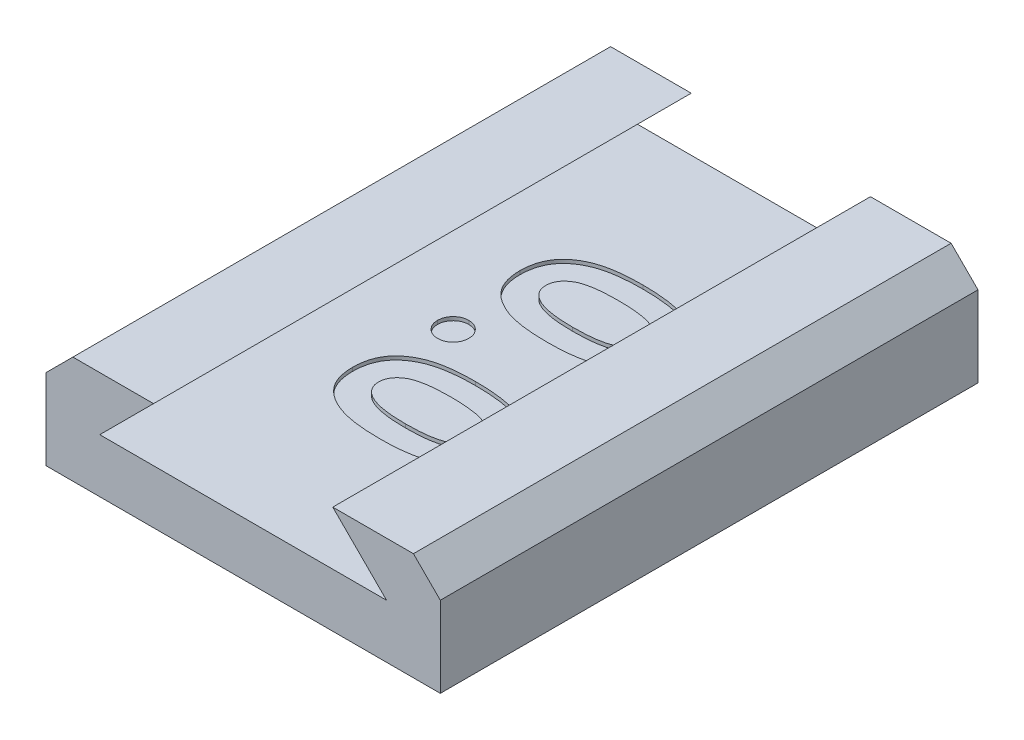
from build123d import *

# Parameters (mm, degrees)
BOSS_EXTRUDE1_DEPTH = 30
CUT_EXTRUDE1_DEPTH  = 0.2


with BuildPart() as part:
    # Sketch2 → Boss-Extrude1 (new body)
    with BuildSketch(Plane.XY):
        Polygon((-11, 0), (11, 0), (11, 4.5), (9.5, 6), (5, 6), (8, 3), (-8, 3), (-5, 6), (-9.5, 6), (-11, 4.5), align=None)
    extrude(amount=BOSS_EXTRUDE1_DEPTH)

    # Sketch3 → Cut-Extrude1 (cut)
    # profile 1 of 3: a face of its own
    with BuildSketch(Plane(origin=(0, 3, 0), x_dir=(1, 0, 0), z_dir=(0, 1, 0))):
        with BuildLine():
            add(Edge.make_bspline(
                [(4.205128205, -10.309294872), (4.204096539, -10.378798339), (4.202068009, -10.515460725), (4.180092686, -10.716737469), (4.146903817, -10.910627333), (4.100582493, -11.097866882), (4.039401501, -11.277188122), (3.965542609, -11.450036956), (3.877239904, -11.614959773), (3.775774169, -11.772338073), (3.662296514, -11.922904814), (3.531126702, -12.06165094), (3.388075011, -12.193946825), (3.230780129, -12.317598794), (3.058169922, -12.431222439), (2.872531062, -12.536938788), (2.672116161, -12.633384573), (2.456720958, -12.721835677), (2.22308076, -12.80096375), (1.968489519, -12.867425049), (1.69312973, -12.92520457), (1.395566859, -12.970707568), (1.076502826, -13.007950694), (0.735340586, -13.032284941), (0.373034871, -13.049213519), (0.124487199, -13.050580011), (-0.003205128, -13.051282051)],
                knots=[0, 0, 0, 0, 0.879087513, 1.728520926, 2.558587148, 3.366762743, 4.166157112, 4.95337177, 5.74258602, 6.530032775, 7.320866164, 8.124307838, 8.942260106, 9.784645725, 10.652593514, 11.554662219, 12.485739241, 13.464770064, 14.499274465, 15.604285219, 16.792026686, 18.057713884, 19.411711354, 20.855437135, 22.384468668, 24, 24, 24, 24], degree=3))
            add(Edge.make_bspline(
                [(-0.003205128, -13.051282051), (-0.132494237, -13.050518019), (-0.383700657, -13.049033519), (-0.749331066, -13.033038967), (-1.092932604, -13.00549581), (-1.414469248, -12.969995521), (-1.713772811, -12.921372178), (-1.991612828, -12.864419894), (-2.247907037, -12.796767856), (-2.482015886, -12.715006135), (-2.69792181, -12.62730987), (-2.897247621, -12.529921108), (-3.083574294, -12.42869995), (-3.254305202, -12.317510485), (-3.409815683, -12.198715784), (-3.551534423, -12.074180805), (-3.677510029, -11.941251875), (-3.790343992, -11.801916952), (-3.889110871, -11.652790258), (-3.973965123, -11.494527753), (-4.04408919, -11.326061535), (-4.10453181, -11.149842373), (-4.148017347, -10.962735358), (-4.182493277, -10.767629484), (-4.201552963, -10.562345726), (-4.203916899, -10.422579353), (-4.205128205, -10.350961538)],
                knots=[0, 0, 0, 0, 1.643682949, 3.193646483, 4.651618242, 6.025629174, 7.305184366, 8.505292942, 9.630500342, 10.672179876, 11.655924581, 12.591484594, 13.491256898, 14.350247848, 15.17884557, 15.977481787, 16.746098769, 17.504475725, 18.254166354, 19.016819136, 19.783753977, 20.571954997, 21.382401421, 22.223156612, 23.089526058, 24, 24, 24, 24], degree=3))
            add(Edge.make_bspline(
                [(-4.205128205, -10.350961538), (-4.20388832, -10.279347065), (-4.201459402, -10.139055365), (-4.182692798, -9.933196708), (-4.147580525, -9.736616301), (-4.104807761, -9.547767987), (-4.043763272, -9.368310273), (-3.972513579, -9.196932121), (-3.887174677, -9.034486728), (-3.788845994, -8.880871758), (-3.676066455, -8.736643485), (-3.55006921, -8.599552096), (-3.411166323, -8.469903167), (-3.257803992, -8.349668272), (-3.092028683, -8.23687878), (-2.911947654, -8.132709721), (-2.717822367, -8.037228221), (-2.509384974, -7.947429554), (-2.282136958, -7.869462787), (-2.034094698, -7.799839436), (-1.762916998, -7.743761995), (-1.469622829, -7.694643096), (-1.153184369, -7.661662856), (-0.815061306, -7.633456539), (-0.454210253, -7.617674882), (-0.206210601, -7.616163014), (-0.078525641, -7.615384615)],
                knots=[0, 0, 0, 0, 0.917197984, 1.796777363, 2.643741708, 3.473481078, 4.273990801, 5.068160217, 5.848535553, 6.620952589, 7.401027954, 8.190319769, 9.003592045, 9.831693788, 10.683727512, 11.569696396, 12.49373307, 13.453184301, 14.474457586, 15.568383184, 16.750575061, 18.019320986, 19.375517054, 20.823796471, 22.364701649, 24, 24, 24, 24], degree=3))
            add(Edge.make_bspline(
                [(-0.078525641, -7.615384615), (0.098882078, -7.616777663), (0.441192557, -7.619465568), (0.93580143, -7.652655328), (1.392642837, -7.702862405), (1.81226877, -7.771592037), (2.193857888, -7.864163361), (2.537300582, -7.977768422), (2.845996494, -8.108122616), (3.028899435, -8.219024518), (3.116987179, -8.272435897)],
                knots=[0, 0, 0, 0, 1.288526675, 2.486228817, 3.599112392, 4.626206381, 5.5730174, 6.447949553, 7.252518174, 8, 8, 8, 8], degree=3))
            add(Edge.make_bspline(
                [(3.116987179, -8.272435897), (3.203522154, -8.334552519), (3.372715082, -8.456002754), (3.594833769, -8.668361885), (3.784800547, -8.896514123), (3.938316297, -9.145145583), (4.059378831, -9.410324058), (4.144883935, -9.694326237), (4.194703192, -9.996103349), (4.201601308, -10.203338726), (4.205128205, -10.309294872)],
                knots=[0, 0, 0, 0, 1.058512271, 2.069600068, 3.047294572, 4.004278952, 4.967380941, 5.939006123, 6.946246673, 8, 8, 8, 8], degree=3))
        make_face()
        with BuildLine():
            add(Edge.make_bspline(
                [(2.769230769, -10.344551282), (2.766229844, -10.281731213), (2.760346437, -10.15857053), (2.71124132, -9.980130436), (2.63374581, -9.812622713), (2.542400975, -9.684396734), (2.453283152, -9.588853512), (2.375110343, -9.519607325), (2.283681022, -9.457590297), (2.182947164, -9.397752397), (2.070136502, -9.344512703), (1.9480944, -9.291573895), (1.812746452, -9.248444008), (1.666643494, -9.205967659), (1.505666534, -9.168832373), (1.328549585, -9.137485805), (1.133960824, -9.110454903), (0.92237195, -9.087630497), (0.692940538, -9.073119231), (0.446200763, -9.05907606), (0.181641992, -9.05396382), (-0.000534918, -9.052194927), (-0.094551282, -9.051282051)],
                knots=[0, 0, 0, 0, 1.076821401, 2.111141558, 3.153197101, 4.23200803, 4.796476379, 5.394298193, 6.020090776, 6.690078086, 7.403703365, 8.159894791, 8.971856079, 9.83973388, 10.771758647, 11.806038152, 12.926526118, 14.143777411, 15.458313878, 16.872423957, 18.385946227, 20, 20, 20, 20], degree=3))
            add(Edge.make_bspline(
                [(-0.094551282, -9.051282051), (-0.216357191, -9.052744166), (-0.449929054, -9.055547881), (-0.785801251, -9.070288869), (-1.091514951, -9.099665593), (-1.368955031, -9.136680813), (-1.617068765, -9.187105234), (-1.835933172, -9.249890892), (-2.027168627, -9.3195164), (-2.187962805, -9.406813602), (-2.32547483, -9.500344907), (-2.444429608, -9.600174831), (-2.543520382, -9.70804451), (-2.627646474, -9.820729662), (-2.690115019, -9.942409138), (-2.735656599, -10.070587854), (-2.76342438, -10.205550352), (-2.767284118, -10.297949794), (-2.769230769, -10.344551282)],
                knots=[0, 0, 0, 0, 1.772047989, 3.398033405, 4.888860297, 6.238411839, 7.468309579, 8.567754056, 9.549141588, 10.421774021, 11.221426488, 11.965694757, 12.675067502, 13.348095901, 14.005005053, 14.656328889, 15.322321954, 16, 16, 16, 16], degree=3))
            add(Edge.make_bspline(
                [(-2.769230769, -10.344551282), (-2.767900305, -10.38955529), (-2.765295422, -10.477667541), (-2.738556643, -10.606154936), (-2.695085196, -10.727661747), (-2.633591782, -10.841821107), (-2.555393499, -10.949041348), (-2.460146708, -11.048798442), (-2.346902021, -11.140340043), (-2.262857716, -11.193672596), (-2.219551282, -11.221153846)],
                knots=[0, 0, 0, 0, 0.992283464, 1.942767638, 2.88273346, 3.832339453, 4.79467288, 5.803907806, 6.868395428, 8, 8, 8, 8], degree=3))
            add(Edge.make_bspline(
                [(-2.219551282, -11.221153846), (-2.160376403, -11.253518382), (-2.036291481, -11.321384188), (-1.826861166, -11.399719453), (-1.590955875, -11.466545436), (-1.326668175, -11.52011496), (-1.035058511, -11.562545619), (-0.715910151, -11.594983866), (-0.368765628, -11.611460343), (-0.128219914, -11.614042589), (-0.003205128, -11.615384615)],
                knots=[0, 0, 0, 0, 0.710996797, 1.490902623, 2.352723643, 3.296875318, 4.334065587, 5.461510359, 6.680713396, 8, 8, 8, 8], degree=3))
            add(Edge.make_bspline(
                [(-0.003205128, -11.615384615), (0.122890968, -11.614856969), (0.365604426, -11.613841339), (0.714048135, -11.59520744), (1.032293681, -11.569258352), (1.319630343, -11.531302198), (1.576756325, -11.482465104), (1.803652662, -11.422271956), (2.000773333, -11.351312588), (2.167900378, -11.267151032), (2.309985721, -11.173975317), (2.431715563, -11.074939563), (2.536515461, -10.969872511), (2.62146023, -10.857642113), (2.689163376, -10.738997334), (2.735301636, -10.613298039), (2.763684343, -10.480962377), (2.767357006, -10.390635382), (2.769230769, -10.344551282)],
                knots=[0, 0, 0, 0, 1.793903324, 3.452957663, 4.963427329, 6.336122014, 7.574844885, 8.684777121, 9.673127442, 10.55010789, 11.340650774, 12.086136756, 12.779466299, 13.446812155, 14.083183996, 14.715685896, 15.34475337, 16, 16, 16, 16], degree=3))
        make_face(mode=Mode.SUBTRACT)
    # profile 2 of 3: a face of its own
    with BuildSketch(Plane(origin=(0, 3, 0), x_dir=(1, 0, 0), z_dir=(0, 1, 0))):
        with BuildLine():
            add(Edge.make_bspline(
                [(-2.358974359, -15.051282051), (-2.362127867, -15.109261342), (-2.368336581, -15.223412551), (-2.415516268, -15.388563246), (-2.498452179, -15.538481226), (-2.60856713, -15.671580457), (-2.739615303, -15.784593386), (-2.890711414, -15.863621), (-3.054423456, -15.914740038), (-3.168948273, -15.920254516), (-3.227564103, -15.923076923)],
                knots=[0, 0, 0, 0, 1.016476041, 2.001265769, 2.982571086, 4.001334304, 5.018889842, 5.99575474, 6.974191785, 8, 8, 8, 8], degree=3))
            add(Edge.make_bspline(
                [(-3.227564103, -15.923076923), (-3.286188977, -15.920273014), (-3.400731466, -15.914794679), (-3.564770158, -15.863271562), (-3.717092216, -15.78471928), (-3.849554026, -15.671571021), (-3.961735316, -15.539035123), (-4.043887545, -15.388219168), (-4.093721365, -15.223726511), (-4.099588165, -15.109316565), (-4.102564103, -15.051282051)],
                knots=[0, 0, 0, 0, 1.022731703, 1.998234309, 2.980426153, 4.002090265, 5.023754376, 6.00211665, 6.986572482, 8, 8, 8, 8], degree=3))
            add(Edge.make_bspline(
                [(-4.102564103, -15.051282051), (-4.099563767, -14.993261286), (-4.093648869, -14.878878442), (-4.044303478, -14.71464108), (-3.961180354, -14.564930406), (-3.849689265, -14.4324278), (-3.71662101, -14.319782789), (-3.565247768, -14.23893184), (-3.400669418, -14.187884217), (-3.286167971, -14.182329951), (-3.227564103, -14.179487179)],
                knots=[0, 0, 0, 0, 1.013910294, 1.9988351, 2.969460266, 3.991611077, 5.013761889, 6.000813773, 6.976781088, 8, 8, 8, 8], degree=3))
            add(Edge.make_bspline(
                [(-3.227564103, -14.179487179), (-3.168969645, -14.182348697), (-3.054486584, -14.187939589), (-2.890228303, -14.238581403), (-2.740089069, -14.319904312), (-2.60843161, -14.432418773), (-2.499002809, -14.565481465), (-2.415106034, -14.714298923), (-2.368409612, -14.879192561), (-2.362152467, -14.993316574), (-2.358974359, -15.051282051)],
                knots=[0, 0, 0, 0, 1.02629359, 2.005193596, 2.986963232, 4.00500024, 5.0242455, 5.997787305, 6.983042999, 8, 8, 8, 8], degree=3))
        make_face()
    # profile 3 of 3: a face of its own
    with BuildSketch(Plane(origin=(0, 3, 0), x_dir=(1, 0, 0), z_dir=(0, 1, 0))):
        with BuildLine():
            add(Edge.make_bspline(
                [(4.205128205, -19.642628205), (4.204096539, -19.712131672), (4.202068009, -19.848794059), (4.180092686, -20.050070802), (4.146903817, -20.243960666), (4.100582493, -20.431200215), (4.039401501, -20.610521455), (3.965542609, -20.78337029), (3.877239904, -20.948293107), (3.775774169, -21.105671406), (3.662296514, -21.256238147), (3.531126702, -21.394984274), (3.388075011, -21.527280158), (3.230780129, -21.650932127), (3.058169922, -21.764555773), (2.872531062, -21.870272121), (2.672116161, -21.966717906), (2.456720958, -22.05516901), (2.22308076, -22.134297083), (1.968489519, -22.200758382), (1.69312973, -22.258537903), (1.395566859, -22.304040901), (1.076502826, -22.341284027), (0.735340586, -22.365618274), (0.373034871, -22.382546853), (0.124487199, -22.383913344), (-0.003205128, -22.384615385)],
                knots=[0, 0, 0, 0, 0.879087513, 1.728520926, 2.558587148, 3.366762743, 4.166157112, 4.95337177, 5.74258602, 6.530032775, 7.320866164, 8.124307838, 8.942260106, 9.784645725, 10.652593514, 11.554662219, 12.485739241, 13.464770064, 14.499274465, 15.604285219, 16.792026686, 18.057713884, 19.411711354, 20.855437135, 22.384468668, 24, 24, 24, 24], degree=3))
            add(Edge.make_bspline(
                [(-0.003205128, -22.384615385), (-0.132494237, -22.383851353), (-0.383700657, -22.382366852), (-0.749331066, -22.3663723), (-1.092932604, -22.338829144), (-1.414469248, -22.303328855), (-1.713772811, -22.254705511), (-1.991612828, -22.197753228), (-2.247907037, -22.130101189), (-2.482015886, -22.048339469), (-2.69792181, -21.960643204), (-2.897247621, -21.863254442), (-3.083574294, -21.762033283), (-3.254305202, -21.650843819), (-3.409815683, -21.532049117), (-3.551534423, -21.407514138), (-3.677510029, -21.274585208), (-3.790343992, -21.135250286), (-3.889110871, -20.986123591), (-3.973965123, -20.827861086), (-4.04408919, -20.659394869), (-4.10453181, -20.483175706), (-4.148017347, -20.296068691), (-4.182493277, -20.100962817), (-4.201552963, -19.895679059), (-4.203916899, -19.755912686), (-4.205128205, -19.684294872)],
                knots=[0, 0, 0, 0, 1.643682949, 3.193646483, 4.651618242, 6.025629174, 7.305184366, 8.505292942, 9.630500342, 10.672179876, 11.655924581, 12.591484594, 13.491256898, 14.350247848, 15.17884557, 15.977481787, 16.746098769, 17.504475725, 18.254166354, 19.016819136, 19.783753977, 20.571954997, 21.382401421, 22.223156612, 23.089526058, 24, 24, 24, 24], degree=3))
            add(Edge.make_bspline(
                [(-4.205128205, -19.684294872), (-4.20388832, -19.612680399), (-4.201459402, -19.472388699), (-4.182692798, -19.266530042), (-4.147580525, -19.069949634), (-4.104807761, -18.881101321), (-4.043763272, -18.701643607), (-3.972513579, -18.530265454), (-3.887174677, -18.367820061), (-3.788845994, -18.214205091), (-3.676066455, -18.069976818), (-3.55006921, -17.932885429), (-3.411166323, -17.8032365), (-3.257803992, -17.683001606), (-3.092028683, -17.570212114), (-2.911947654, -17.466043054), (-2.717822367, -17.370561554), (-2.509384974, -17.280762887), (-2.282136958, -17.202796121), (-2.034094698, -17.133172769), (-1.762916998, -17.077095328), (-1.469622829, -17.027976429), (-1.153184369, -16.99499619), (-0.815061306, -16.966789872), (-0.454210253, -16.951008215), (-0.206210601, -16.949496348), (-0.078525641, -16.948717949)],
                knots=[0, 0, 0, 0, 0.917197984, 1.796777363, 2.643741708, 3.473481078, 4.273990801, 5.068160217, 5.848535553, 6.620952589, 7.401027954, 8.190319769, 9.003592045, 9.831693788, 10.683727512, 11.569696396, 12.49373307, 13.453184301, 14.474457586, 15.568383184, 16.750575061, 18.019320986, 19.375517054, 20.823796471, 22.364701649, 24, 24, 24, 24], degree=3))
            add(Edge.make_bspline(
                [(-0.078525641, -16.948717949), (0.098882078, -16.950110997), (0.441192557, -16.952798901), (0.93580143, -16.985988661), (1.392642837, -17.036195739), (1.81226877, -17.10492537), (2.193857888, -17.197496694), (2.537300582, -17.311101755), (2.845996494, -17.441455949), (3.028899435, -17.552357851), (3.116987179, -17.605769231)],
                knots=[0, 0, 0, 0, 1.288526675, 2.486228817, 3.599112392, 4.626206381, 5.5730174, 6.447949553, 7.252518174, 8, 8, 8, 8], degree=3))
            add(Edge.make_bspline(
                [(3.116987179, -17.605769231), (3.203522154, -17.667885852), (3.372715082, -17.789336087), (3.594833769, -18.001695218), (3.784800547, -18.229847456), (3.938316297, -18.478478917), (4.059378831, -18.743657391), (4.144883935, -19.02765957), (4.194703192, -19.329436682), (4.201601308, -19.536672059), (4.205128205, -19.642628205)],
                knots=[0, 0, 0, 0, 1.058512271, 2.069600068, 3.047294572, 4.004278952, 4.967380941, 5.939006123, 6.946246673, 8, 8, 8, 8], degree=3))
        make_face()
        with BuildLine():
            add(Edge.make_bspline(
                [(2.769230769, -19.677884615), (2.766229844, -19.615064546), (2.760346437, -19.491903863), (2.71124132, -19.313463769), (2.63374581, -19.145956046), (2.542400975, -19.017730067), (2.453283152, -18.922186845), (2.375110343, -18.852940659), (2.283681022, -18.790923631), (2.182947164, -18.73108573), (2.070136502, -18.677846036), (1.9480944, -18.624907229), (1.812746452, -18.581777341), (1.666643494, -18.539300992), (1.505666534, -18.502165707), (1.328549585, -18.470819138), (1.133960824, -18.443788237), (0.92237195, -18.42096383), (0.692940538, -18.406452564), (0.446200763, -18.392409394), (0.181641992, -18.387297154), (-0.000534918, -18.385528261), (-0.094551282, -18.384615385)],
                knots=[0, 0, 0, 0, 1.076821401, 2.111141558, 3.153197101, 4.23200803, 4.796476379, 5.394298193, 6.020090776, 6.690078086, 7.403703365, 8.159894791, 8.971856079, 9.83973388, 10.771758647, 11.806038152, 12.926526118, 14.143777411, 15.458313878, 16.872423957, 18.385946227, 20, 20, 20, 20], degree=3))
            add(Edge.make_bspline(
                [(-0.094551282, -18.384615385), (-0.216357191, -18.3860775), (-0.449929054, -18.388881214), (-0.785801251, -18.403622203), (-1.091514951, -18.432998926), (-1.368955031, -18.470014146), (-1.617068765, -18.520438568), (-1.835933172, -18.583224225), (-2.027168627, -18.652849734), (-2.187962805, -18.740146936), (-2.32547483, -18.833678241), (-2.444429608, -18.933508164), (-2.543520382, -19.041377843), (-2.627646474, -19.154062996), (-2.690115019, -19.275742471), (-2.735656599, -19.403921188), (-2.76342438, -19.538883686), (-2.767284118, -19.631283127), (-2.769230769, -19.677884615)],
                knots=[0, 0, 0, 0, 1.772047989, 3.398033405, 4.888860297, 6.238411839, 7.468309579, 8.567754056, 9.549141588, 10.421774021, 11.221426488, 11.965694757, 12.675067502, 13.348095901, 14.005005053, 14.656328889, 15.322321954, 16, 16, 16, 16], degree=3))
            add(Edge.make_bspline(
                [(-2.769230769, -19.677884615), (-2.767900305, -19.722888623), (-2.765295422, -19.811000874), (-2.738556643, -19.93948827), (-2.695085196, -20.060995081), (-2.633591782, -20.17515444), (-2.555393499, -20.282374681), (-2.460146708, -20.382131776), (-2.346902021, -20.473673377), (-2.262857716, -20.527005929), (-2.219551282, -20.554487179)],
                knots=[0, 0, 0, 0, 0.992283464, 1.942767638, 2.88273346, 3.832339453, 4.79467288, 5.803907806, 6.868395428, 8, 8, 8, 8], degree=3))
            add(Edge.make_bspline(
                [(-2.219551282, -20.554487179), (-2.160376403, -20.586851715), (-2.036291481, -20.654717521), (-1.826861166, -20.733052786), (-1.590955875, -20.799878769), (-1.326668175, -20.853448293), (-1.035058511, -20.895878952), (-0.715910151, -20.928317199), (-0.368765628, -20.944793677), (-0.128219914, -20.947375922), (-0.003205128, -20.948717949)],
                knots=[0, 0, 0, 0, 0.710996797, 1.490902623, 2.352723643, 3.296875318, 4.334065587, 5.461510359, 6.680713396, 8, 8, 8, 8], degree=3))
            add(Edge.make_bspline(
                [(-0.003205128, -20.948717949), (0.122890968, -20.948190302), (0.365604426, -20.947174672), (0.714048135, -20.928540774), (1.032293681, -20.902591685), (1.319630343, -20.864635531), (1.576756325, -20.815798437), (1.803652662, -20.755605289), (2.000773333, -20.684645921), (2.167900378, -20.600484365), (2.309985721, -20.507308651), (2.431715563, -20.408272897), (2.536515461, -20.303205845), (2.62146023, -20.190975446), (2.689163376, -20.072330668), (2.735301636, -19.946631373), (2.763684343, -19.814295711), (2.767357006, -19.723968715), (2.769230769, -19.677884615)],
                knots=[0, 0, 0, 0, 1.793903324, 3.452957663, 4.963427329, 6.336122014, 7.574844885, 8.684777121, 9.673127442, 10.55010789, 11.340650774, 12.086136756, 12.779466299, 13.446812155, 14.083183996, 14.715685896, 15.34475337, 16, 16, 16, 16], degree=3))
        make_face(mode=Mode.SUBTRACT)
    extrude(amount=-CUT_EXTRUDE1_DEPTH, mode=Mode.SUBTRACT)


solid = part.part
